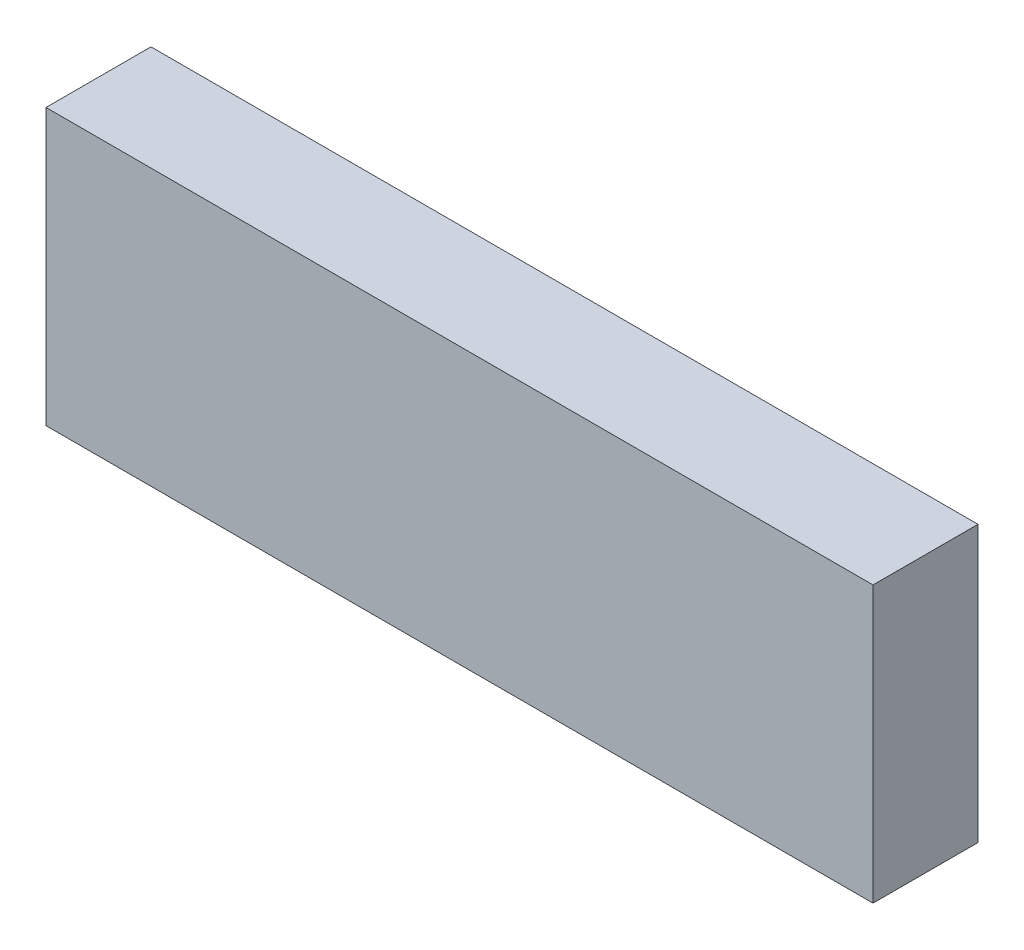
from build123d import *

# Parameters (mm, degrees)
SKETCH1_W           = 90.023693552
SKETCH1_H           = 11.428397622
BOSS_EXTRUDE1_DEPTH = 30


with BuildPart() as part:
    # Sketch1 → Boss-Extrude1 (new body)
    with BuildSketch(Plane(origin=(0, 0, 0), x_dir=(1, 0, 0), z_dir=(0, 1, 0))):
        with Locations((45.011846776, 5.714198811)):
            Rectangle(SKETCH1_W, SKETCH1_H)
    extrude(amount=BOSS_EXTRUDE1_DEPTH)


solid = part.part
